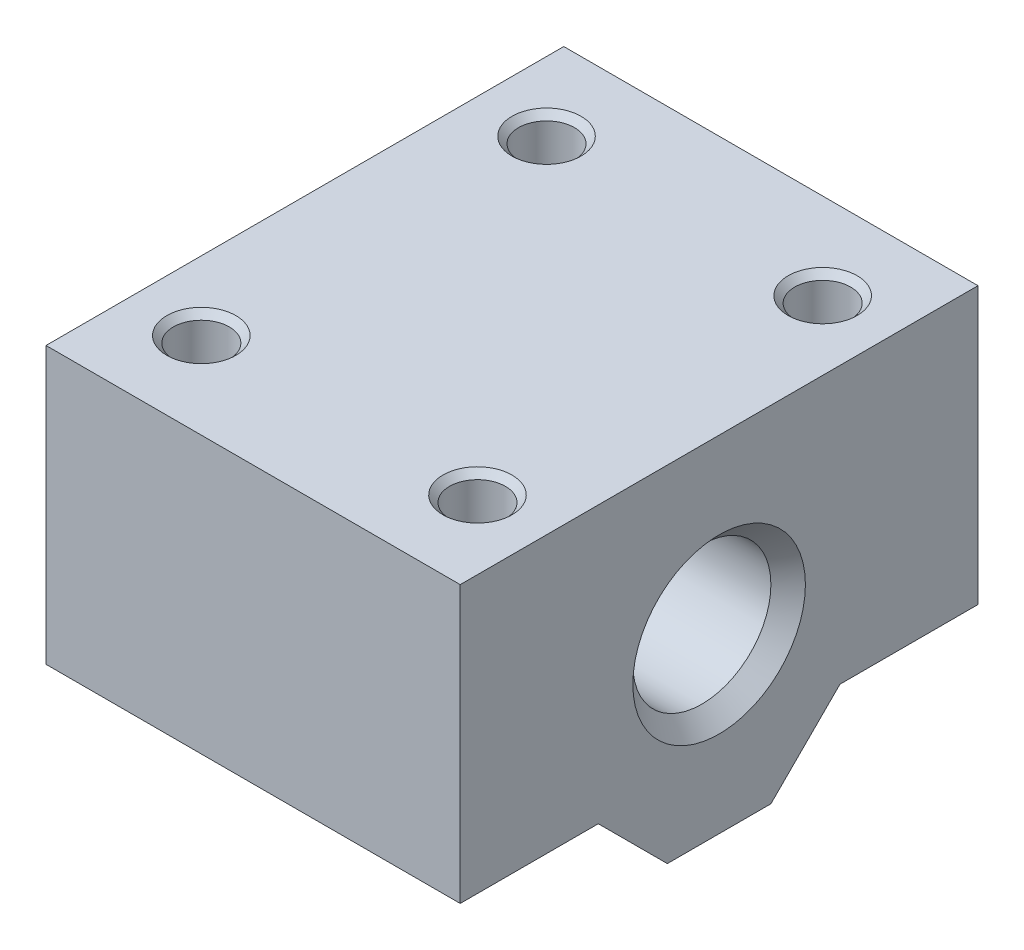
from build123d import *

# Parameters (mm, degrees)
ESQUISSE1_W                   = 24
ESQUISSE1_H                   = 30
BOSS_EXTRU_1_DEPTH            = 20
ESQUISSE2_W                   = 12
ESQUISSE2_H                   = 4
ENL_V_MAT_EXTRU_1_DEPTH       = 31.01666204
ESQUISSE3_W                   = 12
ESQUISSE3_H                   = 4
ENL_V_MAT_EXTRU_2_DEPTH       = 31.01666204
D_POUILLE1_ANGLE              = 45
DIAM_TRE_DU_PER_AGE_8_0_8_1_D = 8
D_GAGEMENT_M31_D              = 3.242
D_GAGEMENT_M31_DEPTH          = 20
CHANFREIN1_SIZE               = 0.379
CHANFREIN2_SIZE               = 1


with BuildPart() as part:
    # Esquisse1 → Boss.-Extru.1 (new body)
    with BuildSketch(Plane(origin=(0, 10, 0), x_dir=(1, 0, 0), z_dir=(0, 1, 0))):
        with Locations((12, 0)):
            Rectangle(ESQUISSE1_W, ESQUISSE1_H)
    extrude(amount=-BOSS_EXTRU_1_DEPTH)

    # Esquisse2 → Enlèv. mat.-Extru.1 (cut, through all)
    with BuildSketch(Plane(origin=(24, 0, 0), x_dir=(0, 0, -1), z_dir=(1, 0, 0))):
        with Locations((9, -8)):
            Rectangle(ESQUISSE2_W, ESQUISSE2_H)
    extrude(amount=-ENL_V_MAT_EXTRU_1_DEPTH, mode=Mode.SUBTRACT)

    # Esquisse3 → Enlèv. mat.-Extru.2 (cut, through all)
    with BuildSketch(Plane(origin=(24, 0, 0), x_dir=(0, 0, -1), z_dir=(1, 0, 0))):
        with Locations((-9, -8)):
            Rectangle(ESQUISSE3_W, ESQUISSE3_H)
    extrude(amount=-ENL_V_MAT_EXTRU_2_DEPTH, mode=Mode.SUBTRACT)

    # Dépouille1
    d_pouille1_faces = [part.faces().sort_by_distance(p)[0] for p in [
        (12, -8, -3),
        (12, -8, 3),
    ]]
    draft(d_pouille1_faces, Plane(origin=(0, -10, 0), x_dir=(0, 0, -1), z_dir=(0, -1, 0)), D_POUILLE1_ANGLE)

    # Diamètre du perçage Ø8.0 (8)1 (through all)
    with Locations(Plane.ZY):
        with Locations((0, 0)):
            Hole(DIAM_TRE_DU_PER_AGE_8_0_8_1_D / 2)

    # Dégagement M31
    with Locations(Plane(origin=(0, 10, 0), x_dir=(1, 0, 0), z_dir=(0, 1, 0))):
        with Locations((20, -10), (4, -10), (4, 10), (20, 10)):
            Hole(D_GAGEMENT_M31_D / 2, depth=D_GAGEMENT_M31_DEPTH)

    # Chanfrein1
    chanfrein1_edges = [part.edges().sort_by_distance(p)[0] for p in [
        (21.621, 10, -10),
        (5.621, 10, -10),
        (5.621, 10, 10),
        (21.621, 10, 10),
    ]]
    chamfer(chanfrein1_edges, length=CHANFREIN1_SIZE)

    # Chanfrein2
    chanfrein2_edges = [part.edges().sort_by_distance(p)[0] for p in [
        (0, 0, 4),
        (24, 0, 4),
    ]]
    chamfer(chanfrein2_edges, length=CHANFREIN2_SIZE)


solid = part.part
